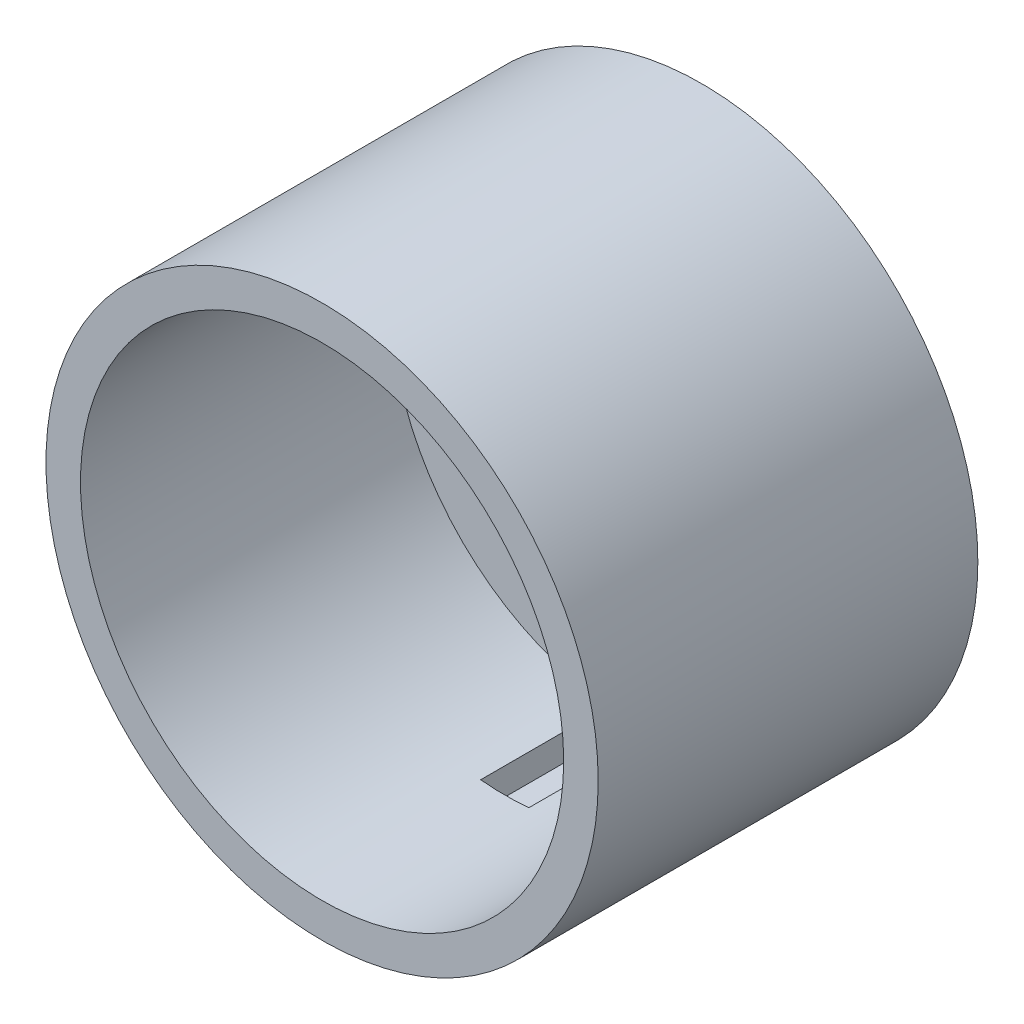
from build123d import *

# Parameters (mm, degrees)
ESQUISSE1_R             = 16
BOSS_EXTRU_1_DEPTH      = 22
ESQUISSE2_W             = 2.8
ESQUISSE2_H             = 31
ENL_V_MAT_EXTRU_1_DEPTH = 11.41
ESQUISSE3_W             = 2.8
ESQUISSE3_H             = 1.9
BOSS_EXTRU_2_DEPTH      = 5
ESQUISSE4_R             = 14
ENL_V_MAT_EXTRU_2_DEPTH = 18


with BuildPart() as part:
    # Esquisse1 → Boss.-Extru.1 (new body)
    with BuildSketch(Plane.XY):
        Circle(ESQUISSE1_R)
    extrude(amount=BOSS_EXTRU_1_DEPTH)

    # Esquisse2 → Enlèv. mat.-Extru.1 (cut)
    with BuildSketch(Plane.XY):
        Rectangle(ESQUISSE2_W, ESQUISSE2_H)
    extrude(amount=ENL_V_MAT_EXTRU_1_DEPTH, mode=Mode.SUBTRACT)

    # Esquisse3 → Boss.-Extru.2 (add)
    with BuildSketch(Plane(origin=(0, 0, 0), x_dir=(-1, 0, 0), z_dir=(0, 0, -1))):
        with Locations((0, -6.25)):
            Rectangle(ESQUISSE3_W, ESQUISSE3_H)
        with Locations((0, 3.95)):
            Rectangle(ESQUISSE3_W, ESQUISSE3_H)
    extrude(amount=-BOSS_EXTRU_2_DEPTH)

    # Esquisse4 → Enlèv. mat.-Extru.2 (cut)
    with BuildSketch(Plane.XY.offset(22)):
        Circle(ESQUISSE4_R)
    extrude(amount=-ENL_V_MAT_EXTRU_2_DEPTH, mode=Mode.SUBTRACT)


solid = part.part
